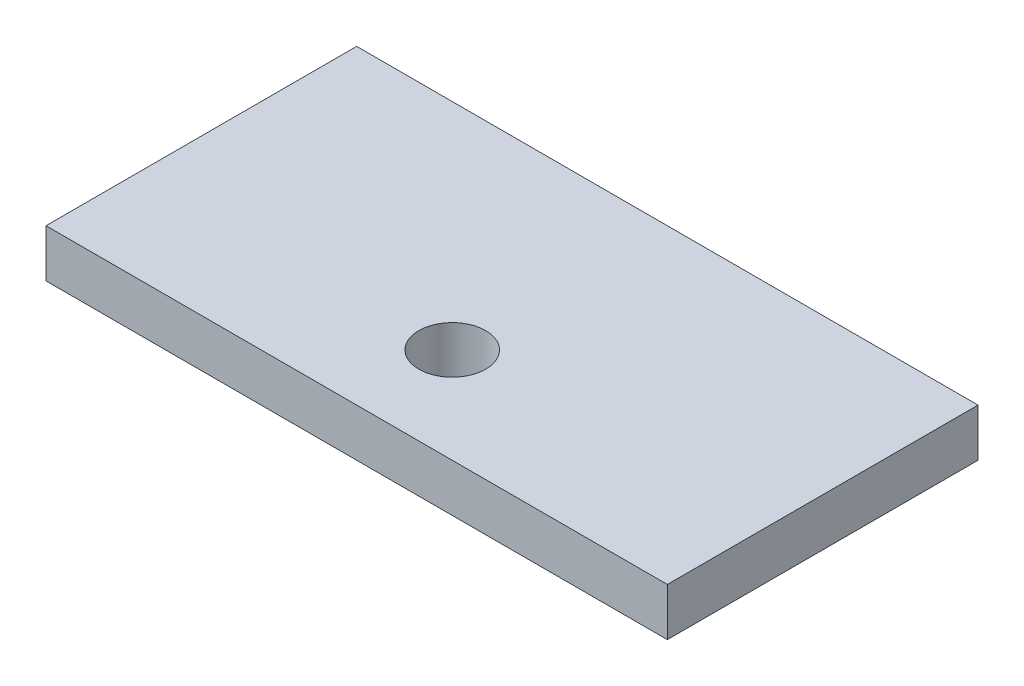
from build123d import *

# Parameters (mm, degrees)
SKETCH1_W               = 130
SKETCH1_H               = 65
BOSS_EXTRUDE1_DEPTH     = 10
CUT_EXTRUDE2_DEPTH      = 74.357003756
CUT_EXTRUDE2_DEPTH_BACK = 74.357003756
SKETCH2_R               = 7


with BuildPart() as part:
    # Sketch1 → Boss-Extrude1 (new body)
    with BuildSketch(Plane(origin=(0, 0, 0), x_dir=(1, 0, 0), z_dir=(0, 1, 0))):
        Rectangle(SKETCH1_W, SKETCH1_H)
    extrude(amount=BOSS_EXTRUDE1_DEPTH)

    # Sketch2 → Cut-Extrude2 (cut, two sides: drawn at the far end of the back side and taken through both)
    with BuildSketch(Plane(origin=(0, 0, 0), x_dir=(1, 0, 0), z_dir=(0, 1, 0)).offset(-CUT_EXTRUDE2_DEPTH_BACK)):
        with Locations(Location((0, -12.5, 0), (0, 0, 270))):
            Circle(SKETCH2_R)
    extrude(amount=CUT_EXTRUDE2_DEPTH + CUT_EXTRUDE2_DEPTH_BACK, mode=Mode.SUBTRACT)


solid = part.part
